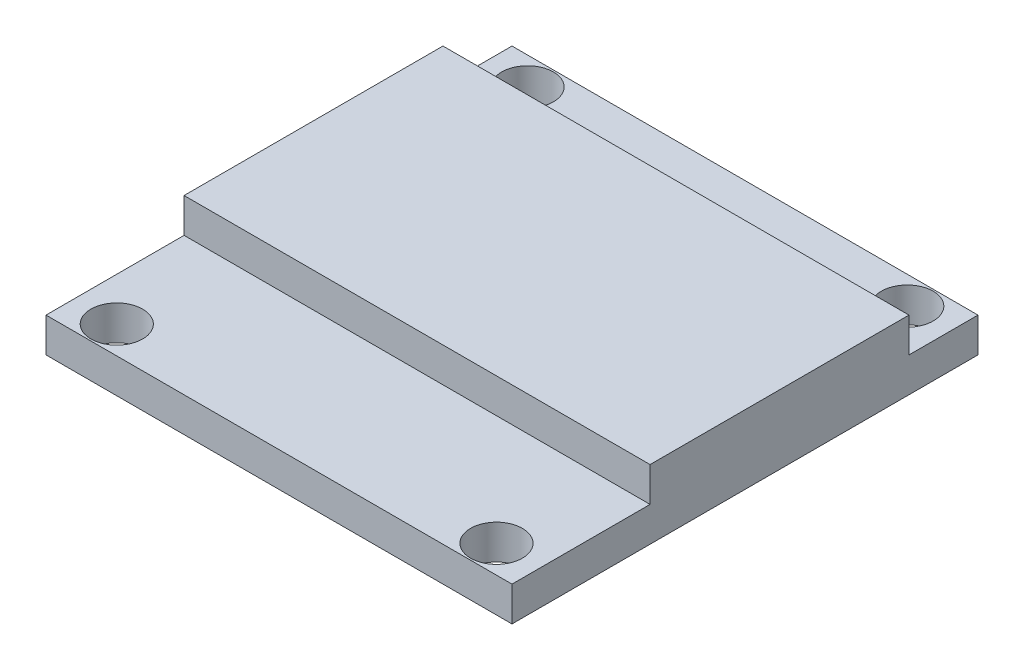
from build123d import *

# Parameters (mm, degrees)
SKETCH1_W           = 27
SKETCH1_H           = 27
SKETCH1_R           = 1.5
BOSS_EXTRUDE1_DEPTH = 2
SKETCH2_W           = 27
SKETCH2_H           = 15
BOSS_EXTRUDE2_DEPTH = 2


with BuildPart() as part:
    # Sketch1 → Boss-Extrude1 (new body)
    with BuildSketch(Plane(origin=(0, 0, 0), x_dir=(1, 0, 0), z_dir=(0, 1, 0))):
        with Locations((13.5, 13.5)):
            Rectangle(SKETCH1_W, SKETCH1_H)
        with Locations(Location((2.5, 25.4, 0), (0, 0, 270))):
            Circle(SKETCH1_R, mode=Mode.SUBTRACT)
        with Locations(Location((24.5, 25.4, 0), (0, 0, 90))):
            Circle(SKETCH1_R, mode=Mode.SUBTRACT)
        with Locations(Location((24.5, 1.6, 0), (0, 0, 270))):
            Circle(SKETCH1_R, mode=Mode.SUBTRACT)
        with Locations(Location((2.5, 1.6, 0), (0, 0, 90))):
            Circle(SKETCH1_R, mode=Mode.SUBTRACT)
    extrude(amount=BOSS_EXTRUDE1_DEPTH)

    # Sketch2 → Boss-Extrude2 (add)
    with BuildSketch(Plane(origin=(0, 2, 0), x_dir=(1, 0, 0), z_dir=(0, 1, 0))):
        with Locations((13.5, 15.5)):
            Rectangle(SKETCH2_W, SKETCH2_H)
    extrude(amount=BOSS_EXTRUDE2_DEPTH)


solid = part.part
